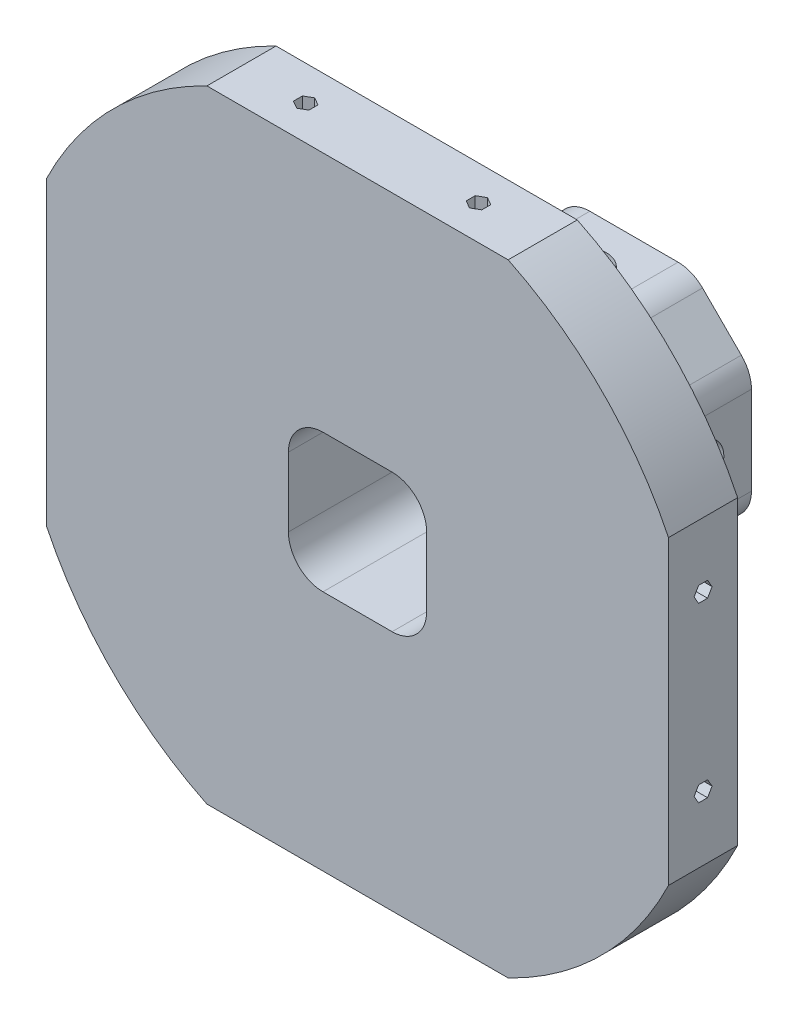
from build123d import *

# Parameters (mm, degrees)
EXTRUDE_1_DEPTH          = 7.5
CUT_EXTRUDE_1_DEPTH      = 30.546573405
CUT_EXTRUDE_1_DEPTH_BACK = 30.546573405
SKETCH_2_W               = 20
SKETCH_2_H               = 20
SKETCH_11_W              = 29.504788154
SKETCH_11_H              = 47.493911142
CUT_EXTRUDE_7_DEPTH      = 1
SKETCH_12_W              = 20.237973212
SKETCH_12_H              = 25.719397838
CUT_EXTRUDE_8_DEPTH      = 1
FILLET_1_R               = 5
FILLET_2_R               = 5
CUT_EXTRUDE_2_DEPTH      = 39.745967532
CUT_EXTRUDE_2_DEPTH_BACK = 39.745967532
SKETCH_3_R               = 4.2
CUT_EXTRUDE_3_DEPTH      = 39.745967532
CUT_EXTRUDE_3_DEPTH_BACK = 39.745967532
SKETCH_4_R               = 4.2
EXTRUDE_2_DEPTH          = 15
SKETCH_6_R               = 4.2
SKETCH_6_R_2             = 3.5
EXTRUDE_3_DEPTH          = 3.4
EXTRUDE_START            = -3.4
SKETCH_13_R              = 4.2
SKETCH_13_R_2            = 3.5
EXTRUDE_4_DEPTH          = 3.4
SKETCH_14_R              = 50
EXTRUDE_5_DEPTH          = 10
CUT_EXTRUDE_START        = -10
CUT_EXTRUDE_9_DEPTH      = 10
CHAMFER_1_SIZE           = 5
CUT_EXTRUDE_10_DEPTH     = 15
PATTERN_CIRCULAR_1_COUNT = 4


with BuildPart() as part:
    # ｽｹｯﾁ1 → ﾎﾞｽ - 押し出し1 (new, symmetric)
    with BuildSketch(Plane.XY):
        Polygon((7.455844123, -18), (18, -7.455844123), (18, 7.455844123), (7.455844123, 18), (-7.455844123, 18), (-18, 7.455844123), (-18, -7.455844123), (-7.455844123, -18), align=None)
    extrude(amount=EXTRUDE_1_DEPTH, both=True)

    # ｽｹｯﾁ2 → ｶｯﾄ - 押し出し1 (cut, two sides: drawn at the far end of the back side and taken through both)
    with BuildSketch(Plane.XY.offset(7.5).offset(-CUT_EXTRUDE_1_DEPTH_BACK)):
        Rectangle(SKETCH_2_W, SKETCH_2_H)
    extrude(amount=CUT_EXTRUDE_1_DEPTH + CUT_EXTRUDE_1_DEPTH_BACK, mode=Mode.SUBTRACT)

    # ｽｹｯﾁ11 → ｶｯﾄ - 押し出し7 (cut)
    with BuildSketch(Plane(origin=(0, 18, 0), x_dir=(1, 0, 0), z_dir=(0, 1, 0))):
        Rectangle(SKETCH_11_W, SKETCH_11_H)
    cut_extrude_7 = extrude(amount=-CUT_EXTRUDE_7_DEPTH, mode=Mode.SUBTRACT)

    # ﾐﾗｰ1: ｶｯﾄ - 押し出し7 across plane
    add(cut_extrude_7.mirror(Plane.ZX), mode=Mode.SUBTRACT)

    # ｽｹｯﾁ12 → ｶｯﾄ - 押し出し8 (cut)
    with BuildSketch(Plane.ZY.offset(18)):
        Rectangle(SKETCH_12_W, SKETCH_12_H)
    cut_extrude_8 = extrude(amount=-CUT_EXTRUDE_8_DEPTH, mode=Mode.SUBTRACT)

    # ﾐﾗｰ2: ｶｯﾄ - 押し出し8 across plane
    add(cut_extrude_8.mirror(Plane(origin=(0, 0, 0), x_dir=(0, 0, 1), z_dir=(1, 0, 0))), mode=Mode.SUBTRACT)

    # ﾌｨﾚｯﾄ1
    fillet_1_edges = [part.edges().sort_by_distance(p)[0] for p in [
        (-10, -10, 0),
        (-10, 10, 0),
        (10, 10, 0),
        (10, -10, 0),
    ]]
    fillet(fillet_1_edges, radius=FILLET_1_R)

    # ﾌｨﾚｯﾄ2
    fillet_2_edges = [part.edges().sort_by_distance(p)[0] for p in [
        (17, 8.455844123, 0),
        (17, -8.455844123, 0),
        (-8.455844123, 17, 0),
        (8.455844123, 17, 0),
        (8.455844123, -17, 0),
        (-8.455844123, -17, 0),
        (-17, -8.455844123, 0),
        (-17, 8.455844123, 0),
    ]]
    fillet(fillet_2_edges, radius=FILLET_2_R)

    # ｽｹｯﾁ3 → ｶｯﾄ - 押し出し2 (cut, two sides: drawn at the far end of the back side and taken through both)
    with BuildSketch(Plane.XZ.offset(17).offset(-CUT_EXTRUDE_2_DEPTH_BACK)):
        with Locations(Location((0, 0, 0), (0, 0, 270))):
            Circle(SKETCH_3_R)
    extrude(amount=CUT_EXTRUDE_2_DEPTH + CUT_EXTRUDE_2_DEPTH_BACK, mode=Mode.SUBTRACT)

    # ｽｹｯﾁ4 → ｶｯﾄ - 押し出し3 (cut, two sides: drawn at the far end of the back side and taken through both)
    with BuildSketch(Plane(origin=(17, 0, 0), x_dir=(0, 0, -1), z_dir=(1, 0, 0)).offset(-CUT_EXTRUDE_3_DEPTH_BACK)):
        Circle(SKETCH_4_R)
    extrude(amount=CUT_EXTRUDE_3_DEPTH + CUT_EXTRUDE_3_DEPTH_BACK, mode=Mode.SUBTRACT)

    # ｽｹｯﾁ5 → ﾎﾞｽ - 押し出し2 (add)
    with BuildSketch(Plane.XY.offset(7.5)):
        with BuildLine():
            Line((17, -6.384776311), (17, 6.384776311))
            ThreePointArc((17, 6.384776311), (16.619397663, 8.298193473), (15.535533906, 9.920310217))
            Line((15.535533906, 9.920310217), (9.920310217, 15.535533906))
            ThreePointArc((9.920310217, 15.535533906), (8.298193473, 16.619397663), (6.384776311, 17))
            Line((6.384776311, 17), (-6.384776311, 17))
            ThreePointArc((-6.384776311, 17), (-8.298193473, 16.619397663), (-9.920310217, 15.535533906))
            Line((-9.920310217, 15.535533906), (-15.535533906, 9.920310217))
            ThreePointArc((-15.535533906, 9.920310217), (-16.619397663, 8.298193473), (-17, 6.384776311))
            Line((-17, 6.384776311), (-17, -6.384776311))
            ThreePointArc((-17, -6.384776311), (-16.619397663, -8.298193473), (-15.535533906, -9.920310217))
            Line((-15.535533906, -9.920310217), (-9.920310217, -15.535533906))
            ThreePointArc((-9.920310217, -15.535533906), (-8.298193473, -16.619397663), (-6.384776311, -17))
            Line((-6.384776311, -17), (6.384776311, -17))
            ThreePointArc((6.384776311, -17), (8.298193473, -16.619397663), (9.920310217, -15.535533906))
            Line((9.920310217, -15.535533906), (15.535533906, -9.920310217))
            ThreePointArc((15.535533906, -9.920310217), (16.619397663, -8.298193473), (17, -6.384776311))
        make_face()
        with BuildLine():
            Line((5, 10), (-5, 10))
            ThreePointArc((-5, 10), (-8.535533906, 8.535533906), (-10, 5))
            Line((-10, 5), (-10, -5))
            ThreePointArc((-10, -5), (-8.535533906, -8.535533906), (-5, -10))
            Line((-5, -10), (5, -10))
            ThreePointArc((5, -10), (8.535533906, -8.535533906), (10, -5))
            Line((10, -5), (10, 5))
            ThreePointArc((10, 5), (8.535533906, 8.535533906), (5, 10))
        make_face(mode=Mode.SUBTRACT)
    extrude(amount=EXTRUDE_2_DEPTH)

    # ｽｹｯﾁ6 → ﾎﾞｽ - 押し出し3 (add)
    with BuildSketch(Plane.XZ.offset(17)):
        Circle(SKETCH_6_R)
        Circle(SKETCH_6_R_2, mode=Mode.SUBTRACT)
    extrude_3 = extrude(amount=-EXTRUDE_3_DEPTH)

    # ﾐﾗｰ3: ﾎﾞｽ - 押し出し3 across plane
    add(extrude_3.mirror(Plane.ZX))

    # ｽｹｯﾁ13 → ﾎﾞｽ - 押し出し4 (add)
    with BuildSketch(Plane.ZY.offset(17).offset(EXTRUDE_START)):
        Circle(SKETCH_13_R)
        Circle(SKETCH_13_R_2, mode=Mode.SUBTRACT)
    extrude_4 = extrude(amount=EXTRUDE_4_DEPTH)

    # ﾐﾗｰ4: ﾎﾞｽ - 押し出し4 across plane
    add(extrude_4.mirror(Plane(origin=(0, 0, 0), x_dir=(0, 0, 1), z_dir=(1, 0, 0))))

    # ｽｹｯﾁ14 → ﾎﾞｽ - 押し出し5 (add)
    with BuildSketch(Plane.XY.offset(22.5)):
        Circle(SKETCH_14_R)
        with BuildLine():
            Line((-5, -10), (5, -10))
            ThreePointArc((5, -10), (8.535533906, -8.535533906), (10, -5))
            Line((10, -5), (10, 5))
            ThreePointArc((10, 5), (8.535533906, 8.535533906), (5, 10))
            Line((5, 10), (-5, 10))
            ThreePointArc((-5, 10), (-8.535533906, 8.535533906), (-10, 5))
            Line((-10, 5), (-10, -5))
            ThreePointArc((-10, -5), (-8.535533906, -8.535533906), (-5, -10))
        make_face(mode=Mode.SUBTRACT)
    extrude(amount=EXTRUDE_5_DEPTH)

    # ｽｹｯﾁ15 → ｶｯﾄ - 押し出し9 (cut)
    with BuildSketch(Plane.XY.offset(32.5).offset(CUT_EXTRUDE_START)):
        with BuildLine():
            ThreePointArc((21.794494718, 45), (0, 50), (-21.794494718, 45))
            Line((-21.794494718, 45), (21.794494718, 45))
        make_face()
        with BuildLine():
            Line((45, 21.794494718), (45, -21.794494718))
            ThreePointArc((45, -21.794494718), (48.733971724, -11.180339887), (50, 0))
            ThreePointArc((50, 0), (48.733971724, 11.180339887), (45, 21.794494718))
        make_face()
        with BuildLine():
            Line((21.794494718, -45), (-21.794494718, -45))
            ThreePointArc((-21.794494718, -45), (0, -50), (21.794494718, -45))
        make_face()
        with BuildLine():
            ThreePointArc((-45, 21.794494718), (-50, 0), (-45, -21.794494718))
            Line((-45, -21.794494718), (-45, 21.794494718))
        make_face()
    extrude(amount=CUT_EXTRUDE_9_DEPTH, mode=Mode.SUBTRACT)

    # 面取り1
    chamfer_1_edges = [part.edges().sort_by_distance(p)[0] for p in [
        (16.619397663, -8.298193473, 22.5),
        (17, 0, 22.5),
        (16.619397663, 8.298193473, 22.5),
        (12.727922061, 12.727922061, 22.5),
        (8.298193473, 16.619397663, 22.5),
        (0, 17, 22.5),
        (-8.298193473, 16.619397663, 22.5),
        (-12.727922061, 12.727922061, 22.5),
        (-16.619397663, 8.298193473, 22.5),
        (-17, 0, 22.5),
        (-16.619397663, -8.298193473, 22.5),
        (-12.727922061, -12.727922061, 22.5),
        (-8.298193473, -16.619397663, 22.5),
        (0, -17, 22.5),
        (8.298193473, -16.619397663, 22.5),
        (12.727922061, -12.727922061, 22.5),
    ]]
    chamfer(chamfer_1_edges, length=CHAMFER_1_SIZE)

    # ｽｹｯﾁ16 → ｶｯﾄ - 押し出し10 (cut)
    with BuildSketch(Plane.ZY.offset(45)):
        Polygon((28.8, 12.5), (28.15, 13.625833025), (26.85, 13.625833025), (26.2, 12.5), (26.85, 11.374166975), (28.15, 11.374166975), align=None)
        Polygon((28.8, -12.5), (28.15, -11.374166975), (26.85, -11.374166975), (26.2, -12.5), (26.85, -13.625833025), (28.15, -13.625833025), align=None)
    cut_extrude_10 = extrude(amount=-CUT_EXTRUDE_10_DEPTH, mode=Mode.SUBTRACT)

    # 円形ﾊﾟﾀｰﾝ1: ｶｯﾄ - 押し出し10 ×4 about axis
    pattern_circular_1_axis = Axis((0, 0, 0), (0, 0, 1))
    for i in range(1, PATTERN_CIRCULAR_1_COUNT):
        add(cut_extrude_10.rotate(pattern_circular_1_axis, i * 360 / PATTERN_CIRCULAR_1_COUNT), mode=Mode.SUBTRACT)


solid = part.part
